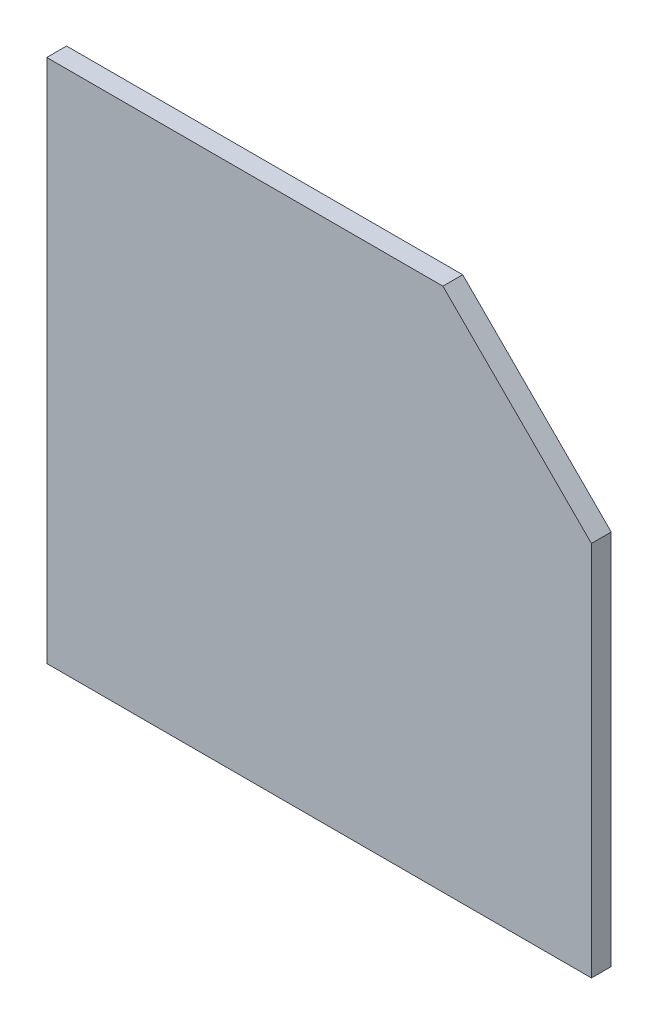
from build123d import *

# Parameters (mm, degrees)
SKETCH1_W               = 1100
SKETCH1_H               = 1060
BOSS_EXTRUDE1_DEPTH     = 40
CUT_EXTRUDE1_DEPTH      = 1529.136119591
CUT_EXTRUDE1_DEPTH_BACK = 40


with BuildPart() as part:
    # Sketch1 → Boss-Extrude1 (new body)
    with BuildSketch(Plane.XY):
        with Locations((-550, 530)):
            Rectangle(SKETCH1_W, SKETCH1_H)
    extrude(amount=BOSS_EXTRUDE1_DEPTH)

    # Sketch2 → Cut-Extrude1 (cut, two sides: drawn at the far end of the back side and taken through both)
    with BuildSketch(Plane.XY.offset(40).offset(-CUT_EXTRUDE1_DEPTH_BACK)):
        Polygon((-2197.89099578, 2957.89099578), (-300, 1060), (0, 760), (1897.89099578, -1137.89099578), (5693.672987339, 2657.89099578), (1597.89099578, 6753.672987339), align=None)
    extrude(amount=CUT_EXTRUDE1_DEPTH + CUT_EXTRUDE1_DEPTH_BACK, mode=Mode.SUBTRACT)


solid = part.part
